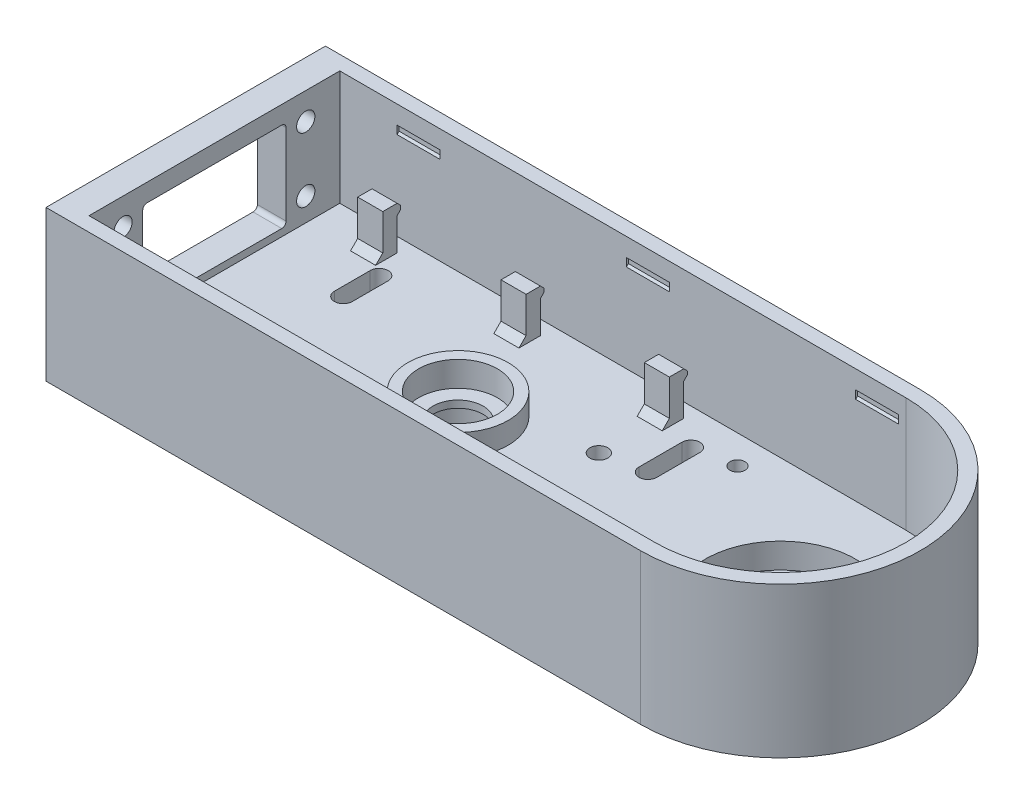
from build123d import *

# Parameters (mm, degrees)
BOSS_EXTRUDE1_DEPTH        = 10
BOSS_EXTRUDE2_DEPTH        = 32
CUT_EXTRUDE1_REACH         = 214.861
SKETCH3_R                  = 2.55
SKETCH3_W                  = 40
SKETCH3_H                  = 25
FILLET1_R                  = 1.2
SKETCH4_R                  = 7
SKETCH4_R_2                = 17.5
CUT_EXTRUDE2_DEPTH         = 174.496397657
SKETCH5_R                  = 21
CUT_EXTRUDE3_DEPTH         = 7
SKETCH6_R                  = 14
SKETCH6_R_2                = 11
BOSS_EXTRUDE3_DEPTH        = 6
CUT_EXTRUDE4_DEPTH         = 174.496397657
SKETCH8_R                  = 11
CUT_EXTRUDE5_DEPTH         = 7
SKETCH9_R                  = 2.1
SKETCH9_R_2                = 2.5
SKETCH9_R_3                = 1.6
CUT_EXTRUDE6_DEPTH         = 174.496397657
BOSS_EXTRUDE4_DEPTH        = 7
CHAMFER1_SIZE              = 2
LPATTERN1_COUNT            = 3
LPATTERN1_PITCH            = 40
CHAMFER1_OF_LPATTERN1_SIZE = 2
CUT_EXTRUDE7_DEPTH         = 12
LPATTERN2_COUNT            = 3
LPATTERN2_PITCH            = 64
MIRROR1_COPY_1_DEPTH       = 12
MIRROR1_COPY_2_DEPTH       = 12
CUT_REVOLVE1_ANGLE         = 20
CUT_EXTRUDE8_START         = -1
SKETCH13_R                 = 11
CUT_EXTRUDE8_DEPTH         = 1


with BuildPart() as part:
    # Sketch1 → Boss-Extrude1 (new body)
    with BuildSketch(Plane(origin=(0, 0, 0), x_dir=(1, 0, 0), z_dir=(0, 1, 0))):
        with BuildLine():
            Line((0, 39), (-166, 39))
            Line((-166, 39), (-166, -39))
            Line((-166, -39), (0, -39))
            ThreePointArc((0, -39), (39, 0), (0, 39))
        make_face()
    extrude(amount=BOSS_EXTRUDE1_DEPTH)

    # Sketch2 → Boss-Extrude2 (add)
    with BuildSketch(Plane(origin=(0, 10, 0), x_dir=(1, 0, 0), z_dir=(0, 1, 0))):
        with BuildLine():
            Line((0, 39), (-166, 39))
            Line((-166, 39), (-166, -39))
            Line((-166, -39), (0, -39))
            ThreePointArc((0, -39), (39, 0), (0, 39))
        make_face()
        with BuildLine():
            Line((0, 35), (-158, 35))
            Line((-158, 35), (-158, -35))
            Line((-158, -35), (0, -35))
            ThreePointArc((0, -35), (35, 0), (0, 35))
        make_face(mode=Mode.SUBTRACT)
    extrude(amount=BOSS_EXTRUDE2_DEPTH)

    # Sketch3 → Cut-Extrude1 (cut, up to next)
    with BuildSketch(Plane.ZY.offset(166), mode=Mode.PRIVATE) as cut_extrude1_sk1:
        with Locations((-25.5, 34.5)):
            Circle(SKETCH3_R)
    cut_extrude1_tool1 = extrude(cut_extrude1_sk1.sketch, amount=-CUT_EXTRUDE1_REACH, mode=Mode.PRIVATE) & part.part
    # Sketch3 → Cut-Extrude1 (cut, up to next)
    with BuildSketch(Plane.ZY.offset(166), mode=Mode.PRIVATE) as cut_extrude1_sk2:
        with Locations((-25.5, 16.5)):
            Circle(SKETCH3_R)
    cut_extrude1_tool2 = extrude(cut_extrude1_sk2.sketch, amount=-CUT_EXTRUDE1_REACH, mode=Mode.PRIVATE) & part.part
    # Sketch3 → Cut-Extrude1 (cut, up to next)
    with BuildSketch(Plane.ZY.offset(166), mode=Mode.PRIVATE) as cut_extrude1_sk3:
        with Locations((25.5, 16.5)):
            Circle(SKETCH3_R)
    cut_extrude1_tool3 = extrude(cut_extrude1_sk3.sketch, amount=-CUT_EXTRUDE1_REACH, mode=Mode.PRIVATE) & part.part
    # Sketch3 → Cut-Extrude1 (cut, up to next)
    with BuildSketch(Plane.ZY.offset(166), mode=Mode.PRIVATE) as cut_extrude1_sk4:
        with Locations((25.5, 34.5)):
            Circle(SKETCH3_R)
    cut_extrude1_tool4 = extrude(cut_extrude1_sk4.sketch, amount=-CUT_EXTRUDE1_REACH, mode=Mode.PRIVATE) & part.part
    # Sketch3 → Cut-Extrude1 (cut, up to next)
    with BuildSketch(Plane.ZY.offset(166), mode=Mode.PRIVATE) as cut_extrude1_sk5:
        with Locations((0, 24.5)):
            Rectangle(SKETCH3_W, SKETCH3_H)
    cut_extrude1_tool5 = extrude(cut_extrude1_sk5.sketch, amount=-CUT_EXTRUDE1_REACH, mode=Mode.PRIVATE) & part.part
    add(cut_extrude1_tool1.solids().sort_by_distance((-166, 34.5, -25.5))[0], mode=Mode.SUBTRACT)
    add(cut_extrude1_tool2.solids().sort_by_distance((-166, 16.5, -25.5))[0], mode=Mode.SUBTRACT)
    add(cut_extrude1_tool3.solids().sort_by_distance((-166, 16.5, 25.5))[0], mode=Mode.SUBTRACT)
    add(cut_extrude1_tool4.solids().sort_by_distance((-166, 34.5, 25.5))[0], mode=Mode.SUBTRACT)
    add(cut_extrude1_tool5.solids().sort_by_distance((-166, 24.5, 0))[0], mode=Mode.SUBTRACT)

    # Fillet1
    fillet1_edges = [part.edges().sort_by_distance(p)[0] for p in [
        (-162, 37, -20),
        (-162, 12, -20),
        (-162, 12, 20),
        (-162, 37, 20),
    ]]
    fillet(fillet1_edges, radius=FILLET1_R)

    # Sketch4 → Cut-Extrude2 (cut, through all)
    with BuildSketch(Plane(origin=(0, 10, 0), x_dir=(1, 0, 0), z_dir=(0, 1, 0))):
        with Locations(Location((-90, 0, 0), (0, 0, 270))):
            Circle(SKETCH4_R)
        with Locations(Location((0, 0, 0), (0, 0, 270))):
            Circle(SKETCH4_R_2)
    extrude(amount=-CUT_EXTRUDE2_DEPTH, mode=Mode.SUBTRACT)

    # Sketch5 → Cut-Extrude3 (cut)
    with BuildSketch(Plane(origin=(0, 10, 0), x_dir=(1, 0, 0), z_dir=(0, 1, 0))):
        with Locations(Location((0, 0, 0), (0, 0, 270))):
            Circle(SKETCH5_R)
    extrude(amount=-CUT_EXTRUDE3_DEPTH, mode=Mode.SUBTRACT)

    # Sketch6 → Boss-Extrude3 (add)
    with BuildSketch(Plane(origin=(0, 10, 0), x_dir=(1, 0, 0), z_dir=(0, 1, 0))):
        with Locations(Location((-90, 0, 0), (0, 0, 270))):
            Circle(SKETCH6_R)
        with Locations(Location((-90, 0, 0), (0, 0, 270))):
            Circle(SKETCH6_R_2, mode=Mode.SUBTRACT)
    extrude(amount=BOSS_EXTRUDE3_DEPTH)

    # Sketch7 → Cut-Extrude4 (cut, through all)
    with BuildSketch(Plane(origin=(0, 10, 0), x_dir=(1, 0, 0), z_dir=(0, 1, 0))):
        with BuildLine():
            Line((-132.5, 23), (-132.5, 13))
            ThreePointArc((-132.5, 13), (-135, 10.5), (-137.5, 13))
            Line((-137.5, 13), (-137.5, 23))
            ThreePointArc((-137.5, 23), (-135, 25.5), (-132.5, 23))
        make_face()
        with BuildLine():
            Line((-132.5, -13), (-132.5, -23))
            ThreePointArc((-132.5, -23), (-135, -25.5), (-137.5, -23))
            Line((-137.5, -23), (-137.5, -13))
            ThreePointArc((-137.5, -13), (-135, -10.5), (-132.5, -13))
        make_face()
        with BuildLine():
            Line((-47.5, 25), (-47.5, 13))
            ThreePointArc((-47.5, 13), (-50, 10.5), (-52.5, 13))
            Line((-52.5, 13), (-52.5, 25))
            ThreePointArc((-52.5, 25), (-50, 27.5), (-47.5, 25))
        make_face()
        with BuildLine():
            Line((-47.5, -21), (-47.5, -25))
            ThreePointArc((-47.5, -25), (-50, -27.5), (-52.5, -25))
            Line((-52.5, -25), (-52.5, -21))
            ThreePointArc((-52.5, -21), (-50, -18.5), (-47.5, -21))
        make_face()
    extrude(amount=-CUT_EXTRUDE4_DEPTH, mode=Mode.SUBTRACT)

    # Sketch8 → Cut-Extrude5 (cut)
    with BuildSketch(Plane.XZ):
        with Locations(Location((-90, 0, 0), (0, 0, 90))):
            Circle(SKETCH8_R)
    extrude(amount=-CUT_EXTRUDE5_DEPTH, mode=Mode.SUBTRACT)

    # Sketch9 → Cut-Extrude6 (cut, through all)
    with BuildSketch(Plane(origin=(0, 10, 0), x_dir=(1, 0, 0), z_dir=(0, 1, 0))):
        with Locations(Location((-39, 27, 0), (0, 0, 270))):
            Circle(SKETCH9_R)
        with Locations(Location((-61.5, 10.809700388, 0), (0, 0, 270))):
            Circle(SKETCH9_R_2)
        with Locations(Location((-58, -9.459979846, 0), (0, 0, 270))):
            Circle(SKETCH9_R_3)
        with Locations(Location((-49.611997868, -5, 0), (0, 0, 270))):
            Circle(SKETCH9_R_3)
    extrude(amount=-CUT_EXTRUDE6_DEPTH, mode=Mode.SUBTRACT)

    # Sketch10 → Boss-Extrude4 (add)
    with BuildSketch(Plane(origin=(-145, 0, 0), x_dir=(0, 0, -1), z_dir=(1, 0, 0))):
        Polygon((27, 10), (31, 10), (31, 19), (32, 20), (32, 21), (31, 22), (27, 22), align=None)
    boss_extrude4 = extrude(amount=BOSS_EXTRUDE4_DEPTH)

    # Chamfer1
    chamfer1_edges = [part.edges().sort_by_distance(p)[0] for p in [
        (-141.5, 10, -27),
    ]]
    chamfer(chamfer1_edges, length=CHAMFER1_SIZE)

    # LPattern1: Boss-Extrude4 ×3
    with Locations(*[(i * LPATTERN1_PITCH, 0, 0) for i in range(1, LPATTERN1_COUNT)]):
        add(boss_extrude4)

    # Chamfer1 of LPattern1
    chamfer1_of_lpattern1_edges = [part.edges().sort_by_distance(p)[0] for p in [
        (-101.5, 10, -27),
        (-61.5, 10, -27),
    ]]
    chamfer(chamfer1_of_lpattern1_edges, length=CHAMFER1_OF_LPATTERN1_SIZE)

    # Sketch11 → Cut-Extrude7 (cut)
    with BuildSketch(Plane.ZY.offset(142)):
        Polygon((-35, 34.6), (-35, 36.9), (-35.55, 36.35), (-35.55, 35.15), align=None)
    cut_extrude7 = extrude(amount=-CUT_EXTRUDE7_DEPTH, mode=Mode.SUBTRACT)

    # LPattern2: Cut-Extrude7 ×3
    with Locations(*[(i * LPATTERN2_PITCH, 0, 0) for i in range(1, LPATTERN2_COUNT)]):
        add(cut_extrude7, mode=Mode.SUBTRACT)

    # Mirror1: Cut-Extrude7 across plane
    add(cut_extrude7.mirror(Plane.XY), mode=Mode.SUBTRACT)

    # Mirror1 copy 1 sketch → Mirror1 copy 1 (cut)
    with BuildSketch(Plane(origin=(-78, 0, 0), x_dir=(0, 0, -1), z_dir=(-1, 0, 0))):
        Polygon((-35, -34.6), (-35, -36.9), (-35.55, -36.35), (-35.55, -35.15), align=None)
    extrude(amount=-MIRROR1_COPY_1_DEPTH, mode=Mode.SUBTRACT)

    # Mirror1 copy 2 sketch → Mirror1 copy 2 (cut)
    with BuildSketch(Plane(origin=(-14, 0, 0), x_dir=(0, 0, -1), z_dir=(-1, 0, 0))):
        Polygon((-35, -34.6), (-35, -36.9), (-35.55, -36.35), (-35.55, -35.15), align=None)
    extrude(amount=-MIRROR1_COPY_2_DEPTH, mode=Mode.SUBTRACT)

    # Sketch12 → Cut-Revolve1 (revolve, symmetric, cut)
    with BuildSketch(Plane.XY) as cut_revolve1_sk:
        Polygon((35.55, 36.35), (35, 36.9), (35, 34.6), (35.55, 35.15), align=None)
    revolve(axis=Axis((0, 42, 0), (0, -1, 0)), revolution_arc=CUT_REVOLVE1_ANGLE / 2, mode=Mode.SUBTRACT)
    revolve(cut_revolve1_sk.sketch, axis=Axis((0, 42, 0), (0, 1, 0)), revolution_arc=CUT_REVOLVE1_ANGLE / 2, mode=Mode.SUBTRACT)

    # Sketch13 → Cut-Extrude8 (cut)
    with BuildSketch(Plane(origin=(0, 10, 0), x_dir=(1, 0, 0), z_dir=(0, 1, 0)).offset(CUT_EXTRUDE8_START)):
        with Locations(Location((-90, 0, 0), (0, 0, 270))):
            Circle(SKETCH13_R)
    extrude(amount=CUT_EXTRUDE8_DEPTH, mode=Mode.SUBTRACT)


solid = part.part
